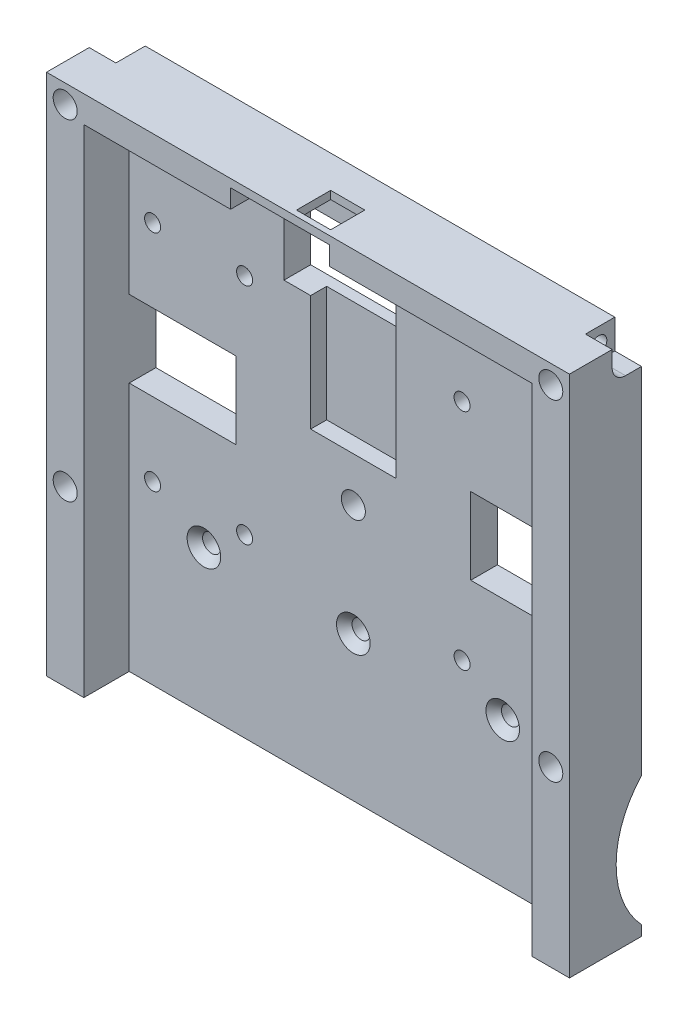
from build123d import *

# Parameters (mm, degrees)
SKETCH1_W                                       = 98
SKETCH1_H                                       = 80
BOSS_EXTRUDE1_DEPTH                             = 5
SKETCH2_W                                       = 7
SKETCH2_H                                       = 80
BOSS_EXTRUDE2_DEPTH                             = 8.5
SKETCH3_W                                       = 7
SKETCH3_H                                       = 80
BOSS_EXTRUDE3_DEPTH                             = 8.5
SKETCH8_W                                       = 84
SKETCH8_H                                       = 8.5
BOSS_EXTRUDE5_DEPTH                             = 5
SKETCH13_R                                      = 2.25
CUT_EXTRUDE7_DEPTH                              = 3.2
SKETCH15_R                                      = 1.5
CUT_EXTRUDE9_DEPTH                              = 3.2
SKETCH14_W                                      = 16
SKETCH14_H                                      = 16
CUT_EXTRUDE13_DEPTH                             = 3
SKETCH18_W                                      = 16
SKETCH18_H                                      = 12
CUT_EXTRUDE14_DEPTH                             = 64.822018144
SKETCH19_W                                      = 16
SKETCH19_H                                      = 5.672791846
CUT_EXTRUDE15_DEPTH                             = 3
SKETCH20_R                                      = 2.25
CUT_EXTRUDE20_DEPTH                             = 3.2
BOSS_EXTRUDE7_DEPTH                             = 10
BOSS_EXTRUDE9_DEPTH                             = 8
CSK_FOR_M3_FLAT_HEAD_MACHINE_SCREW1_D           = 3.4
CSK_FOR_M3_FLAT_HEAD_MACHINE_SCREW1_CSINK_D     = 6.3
CSK_FOR_M3_FLAT_HEAD_MACHINE_SCREW1_CSINK_ANGLE = 90
SKETCH51_R                                      = 17.75
CUT_EXTRUDE23_DEPTH                             = 8
CUT_EXTRUDE24_START                             = -8
SKETCH52_R                                      = 17.75
CUT_EXTRUDE24_DEPTH                             = 8
SKETCH42_R                                      = 2.25
CUT_EXTRUDE25_DEPTH                             = 4.25
SKETCH53_R                                      = 2.25
CUT_EXTRUDE26_DEPTH                             = 8.25
SKETCH54_R                                      = 1.5
CUT_EXTRUDE27_DEPTH                             = 13.25
CUT_EXTRUDE28_DEPTH                             = 5
CUT_EXTRUDE29_START                             = -13.25
SKETCH56_R                                      = 1.5
CUT_EXTRUDE29_DEPTH                             = 13.25
CUT_EXTRUDE30_START                             = -5
CUT_EXTRUDE30_DEPTH                             = 5
SKETCH65_W                                      = 20
SKETCH65_H                                      = 14.4
CUT_EXTRUDE31_DEPTH                             = 77.401897882
CUT_EXTRUDE33_DEPTH                             = 13.5
SKETCH75_W                                      = 28.5
SKETCH75_H                                      = 7
CUT_EXTRUDE39_DEPTH                             = 11
SKETCH80_W                                      = 5
SKETCH80_H                                      = 12
CUT_EXTRUDE42_DEPTH                             = 77.401897882
SKETCH82_W                                      = 0.8
SKETCH82_H                                      = 7
SKETCH82_W_2                                    = 0.2
CUT_EXTRUDE43_DEPTH                             = 11
SKETCH84_W                                      = 5.5
SKETCH84_H                                      = 8.5
SKETCH84_R                                      = 1.5
BOSS_EXTRUDE10_DEPTH                            = 3.5
SKETCH86_W                                      = 5.5
SKETCH86_H                                      = 3.5
BOSS_EXTRUDE11_DEPTH                            = 3.5


with BuildPart() as part:
    # Sketch1 → Boss-Extrude1 (new body)
    with BuildSketch(Plane.XY):
        Rectangle(SKETCH1_W, SKETCH1_H)
    extrude(amount=BOSS_EXTRUDE1_DEPTH)

    # Sketch2 → Boss-Extrude2 (add)
    with BuildSketch(Plane.XY.offset(5)):
        with Locations((-45.5, 0)):
            Rectangle(SKETCH2_W, SKETCH2_H)
    extrude(amount=BOSS_EXTRUDE2_DEPTH)

    # Sketch3 → Boss-Extrude3 (add)
    with BuildSketch(Plane.XY.offset(5)):
        with Locations((45.5, 0)):
            Rectangle(SKETCH3_W, SKETCH3_H)
    extrude(amount=BOSS_EXTRUDE3_DEPTH)

    # Sketch8 → Boss-Extrude5 (add)
    with BuildSketch(Plane(origin=(0, 40, 0), x_dir=(1, 0, 0), z_dir=(0, 1, 0))):
        with Locations((0, -9.25)):
            Rectangle(SKETCH8_W, SKETCH8_H)
    extrude(amount=-BOSS_EXTRUDE5_DEPTH)

    # Sketch13 → Cut-Extrude7 (cut)
    with BuildSketch(Plane.XY.offset(5)):
        with Locations((0, -10)):
            Circle(SKETCH13_R)
    extrude(amount=-CUT_EXTRUDE7_DEPTH, mode=Mode.SUBTRACT)

    # Sketch15 → Cut-Extrude9 (cut)
    with BuildSketch(Plane.XY.offset(5)):
        with Locations((-37.62, 17)):
            Circle(SKETCH15_R)
        with Locations((-20.38, 17)):
            Circle(SKETCH15_R)
        with Locations((-37.62, -25)):
            Circle(SKETCH15_R)
        with Locations((-20.38, -25)):
            Circle(SKETCH15_R)
        with Locations((20.38, -25)):
            Circle(SKETCH15_R)
        with Locations((37.62, -25)):
            Circle(SKETCH15_R)
        with Locations((37.62, 17)):
            Circle(SKETCH15_R)
        with Locations((20.38, 17)):
            Circle(SKETCH15_R)
    extrude(amount=-CUT_EXTRUDE9_DEPTH, mode=Mode.SUBTRACT)

    # Sketch14 → Cut-Extrude13 (cut)
    with BuildSketch(Plane.XY.offset(5)):
        with Locations((0, 6.327208154)):
            Rectangle(SKETCH14_W, SKETCH14_H)
    extrude(amount=-CUT_EXTRUDE13_DEPTH, mode=Mode.SUBTRACT)

    # Sketch18 → Cut-Extrude14 (cut, through all)
    with BuildSketch(Plane.XY.offset(5)):
        with Locations((0, 26)):
            Rectangle(SKETCH18_W, SKETCH18_H)
    extrude(amount=-CUT_EXTRUDE14_DEPTH, mode=Mode.SUBTRACT)

    # Sketch19 → Cut-Extrude15 (cut)
    with BuildSketch(Plane.XY.offset(5)):
        with Locations((0, 17.163604077)):
            Rectangle(SKETCH19_W, SKETCH19_H)
    extrude(amount=-CUT_EXTRUDE15_DEPTH, mode=Mode.SUBTRACT)

    # Sketch20 → Cut-Extrude20 (cut)
    with BuildSketch(Plane(origin=(0, 0, 0), x_dir=(-1, 0, 0), z_dir=(0, 0, -1))):
        with Locations((18.25, 21.5)):
            Circle(SKETCH20_R)
        with Locations((-18.25, 21.5)):
            Circle(SKETCH20_R)
        with Locations((18.25, -15)):
            Circle(SKETCH20_R)
        with Locations((-18.25, -15)):
            Circle(SKETCH20_R)
    extrude(amount=-CUT_EXTRUDE20_DEPTH, mode=Mode.SUBTRACT)

    # Sketch26 → Boss-Extrude7 (add)
    with BuildSketch(Plane(origin=(0, -40, 0), x_dir=(-1, 0, 0), z_dir=(0, -1, 0))):
        Polygon((49, -13.5), (42, -13.5), (42, -5), (-42, -5), (-42, -13.5), (-49, -13.5), (-49, 0), (49, 0), align=None)
    extrude(amount=BOSS_EXTRUDE7_DEPTH)

    # Sketch47 → Boss-Extrude9 (add)
    with BuildSketch(Plane(origin=(0, -50, 0), x_dir=(-1, 0, 0), z_dir=(0, -1, 0))):
        Polygon((49, -13.5), (42, -13.5), (42, -5), (-42, -5), (-42, -13.5), (-49, -13.5), (-49, 0), (49, 0), align=None)
    extrude(amount=BOSS_EXTRUDE9_DEPTH)

    # CSK for M3 Flat Head Machine Screw1 (through all)
    with Locations(Plane.XY.offset(5)):
        with Locations((28, -30.88), (0, -30.88), (-28, -30.88)):
            CounterSinkHole(CSK_FOR_M3_FLAT_HEAD_MACHINE_SCREW1_D / 2, CSK_FOR_M3_FLAT_HEAD_MACHINE_SCREW1_CSINK_D / 2, counter_sink_angle=CSK_FOR_M3_FLAT_HEAD_MACHINE_SCREW1_CSINK_ANGLE)

    # Sketch51 → Cut-Extrude23 (cut)
    with BuildSketch(Plane.ZY.offset(49)):
        with Locations((-13, -44)):
            Circle(SKETCH51_R)
    extrude(amount=-CUT_EXTRUDE23_DEPTH, mode=Mode.SUBTRACT)

    # Sketch52 → Cut-Extrude24 (cut)
    with BuildSketch(Plane(origin=(49, 0, 0), x_dir=(0, 0, -1), z_dir=(1, 0, 0)).offset(CUT_EXTRUDE24_START)):
        with Locations((13, -44)):
            Circle(SKETCH52_R)
    extrude(amount=CUT_EXTRUDE24_DEPTH, mode=Mode.SUBTRACT)

    # Sketch42 → Cut-Extrude25 (cut)
    with BuildSketch(Plane.XY.offset(13.5)):
        with Locations((-45.5, 36.5)):
            Circle(SKETCH42_R)
        with Locations((45.5, 36.5)):
            Circle(SKETCH42_R)
    extrude(amount=-CUT_EXTRUDE25_DEPTH, mode=Mode.SUBTRACT)

    # Sketch53 → Cut-Extrude26 (cut)
    with BuildSketch(Plane.XY.offset(13.5)):
        with Locations((-45.5, -25.5)):
            Circle(SKETCH53_R)
        with Locations((45.5, -25.5)):
            Circle(SKETCH53_R)
    extrude(amount=-CUT_EXTRUDE26_DEPTH, mode=Mode.SUBTRACT)

    # Sketch54 → Cut-Extrude27 (cut)
    with BuildSketch(Plane.ZY.offset(49)):
        with Locations((3, 37)):
            Circle(SKETCH54_R)
    extrude(amount=-CUT_EXTRUDE27_DEPTH, mode=Mode.SUBTRACT)

    # Sketch55 → Cut-Extrude28 (cut)
    with BuildSketch(Plane.ZY.offset(49)):
        with BuildLine():
            Line((5.5, 37), (5.5, 40))
            Line((5.5, 40), (0, 40))
            Line((0, 40), (0, 34.5))
            Line((0, 34.5), (3, 34.5))
            ThreePointArc((3, 34.5), (4.767766953, 35.232233047), (5.5, 37))
        make_face()
    extrude(amount=-CUT_EXTRUDE28_DEPTH, mode=Mode.SUBTRACT)

    # Sketch56 → Cut-Extrude29 (cut)
    with BuildSketch(Plane(origin=(49, 0, 0), x_dir=(0, 0, -1), z_dir=(1, 0, 0)).offset(CUT_EXTRUDE29_START)):
        with Locations(Location((-3, 37, 0), (0, 0, 180))):
            Circle(SKETCH56_R)
    extrude(amount=CUT_EXTRUDE29_DEPTH, mode=Mode.SUBTRACT)

    # Sketch57 → Cut-Extrude30 (cut)
    with BuildSketch(Plane(origin=(49, 0, 0), x_dir=(0, 0, -1), z_dir=(1, 0, 0)).offset(CUT_EXTRUDE30_START)):
        with BuildLine():
            Line((-5.5, 37), (-5.5, 40))
            Line((-5.5, 40), (0, 40))
            Line((0, 40), (0, 34.5))
            Line((0, 34.5), (-3, 34.5))
            ThreePointArc((-3, 34.5), (-4.767766953, 35.232233047), (-5.5, 37))
        make_face()
    extrude(amount=CUT_EXTRUDE30_DEPTH, mode=Mode.SUBTRACT)

    # Sketch65 → Cut-Extrude31 (cut, through all)
    with BuildSketch(Plane.XY.offset(5)):
        with Locations((32, -4)):
            Rectangle(SKETCH65_W, SKETCH65_H)
        with Locations((-32, -4)):
            Rectangle(SKETCH65_W, SKETCH65_H)
    extrude(amount=-CUT_EXTRUDE31_DEPTH, mode=Mode.SUBTRACT)

    # Sketch69 → Cut-Extrude33 (cut)
    with BuildSketch(Plane.XZ.offset(-35)):
        Polygon((0, 12.45), (3.2, 12.45), (3.2, 6.05), (-3.2, 6.05), (-3.2, 12.45), align=None)
    extrude(amount=-CUT_EXTRUDE33_DEPTH, mode=Mode.SUBTRACT)

    # Sketch75 → Cut-Extrude39 (cut)
    with BuildSketch(Plane.XY.offset(13.5)):
        with Locations((-4.95, 35)):
            Rectangle(SKETCH75_W, SKETCH75_H)
    extrude(amount=-CUT_EXTRUDE39_DEPTH, mode=Mode.SUBTRACT)

    # Sketch80 → Cut-Extrude42 (cut, through all)
    with BuildSketch(Plane.XY.offset(5)):
        with Locations((-10.5, 26)):
            Rectangle(SKETCH80_W, SKETCH80_H)
    extrude(amount=-CUT_EXTRUDE42_DEPTH, mode=Mode.SUBTRACT)

    # Sketch82 → Cut-Extrude43 (cut)
    with BuildSketch(Plane.XY.offset(13.5)):
        with Locations((-19.6, 35)):
            Rectangle(SKETCH82_W, SKETCH82_H)
        with Locations((9.4, 35)):
            Rectangle(SKETCH82_W_2, SKETCH82_H)
    extrude(amount=-CUT_EXTRUDE43_DEPTH, mode=Mode.SUBTRACT)

    # Sketch84 → Boss-Extrude10 (add)
    # profile 1 of 2: a face of its own
    with BuildSketch(Plane.XZ.offset(-38.5)):
        with Locations((-17.25, 9.25)):
            Rectangle(SKETCH84_W, SKETCH84_H)
        with Locations(Location((-17, 9.05, 0), (0, 0, 270))):
            Circle(SKETCH84_R, mode=Mode.SUBTRACT)
    # profile 2 of 2: a face of its own
    with BuildSketch(Plane.XZ.offset(-38.5)):
        with Locations((6.75, 9.25)):
            Rectangle(SKETCH84_W, SKETCH84_H)
        with Locations(Location((6.5, 9.05, 0), (0, 0, 270))):
            Circle(SKETCH84_R, mode=Mode.SUBTRACT)
    extrude(amount=BOSS_EXTRUDE10_DEPTH)

    # Sketch86 → Boss-Extrude11 (add)
    with BuildSketch(Plane.XY.offset(2.5)):
        with Locations((-17.25, 36.75)):
            Rectangle(SKETCH86_W, SKETCH86_H)
        with Locations((6.75, 36.75)):
            Rectangle(SKETCH86_W, SKETCH86_H)
    extrude(amount=BOSS_EXTRUDE11_DEPTH)


solid = part.part
